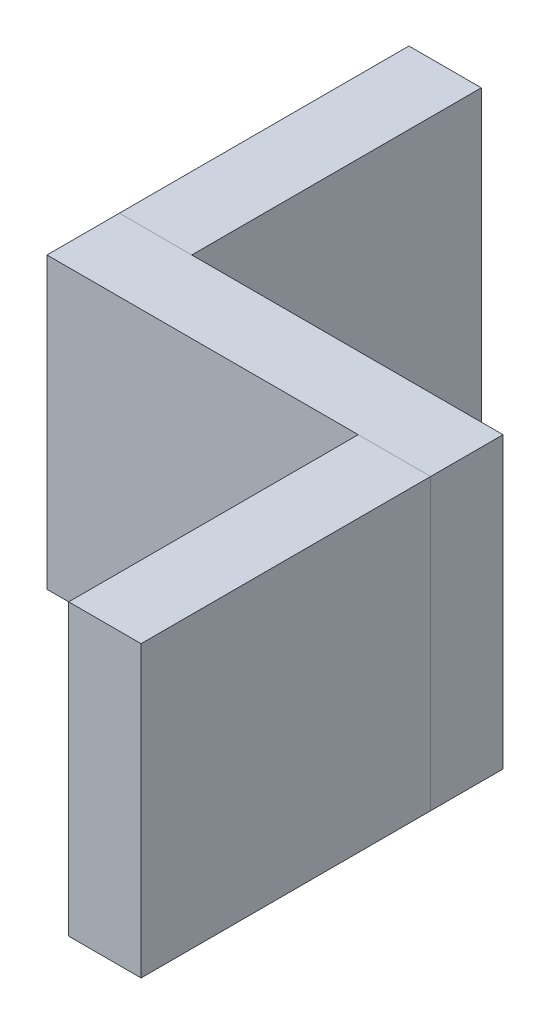
from build123d import *

# Parameters (mm, degrees)
SKETCH_1_W        = 53
SKETCH_1_H        = 40
EXTRUDE_1_DEPTH   = 5
SKETCH_2_W        = 10
SKETCH_2_H        = 40
EXTRUDE_2_DEPTH   = 40
EXTRUDE_2_2_DEPTH = 40


with BuildPart() as part:
    # 草图1 → 凸台-拉伸1 (new, symmetric)
    with BuildSketch(Plane.XY):
        Rectangle(SKETCH_1_W, SKETCH_1_H)
    extrude(amount=EXTRUDE_1_DEPTH, both=True)


with BuildPart() as body_2:
    # 草图2 → 凸台-拉伸2 (new, through all)
    with BuildSketch(Plane.XZ.offset(20)):
        with Locations((-21.5, -25)):
            Rectangle(SKETCH_2_W, SKETCH_2_H)
    extrude(amount=-EXTRUDE_2_DEPTH)


with BuildPart() as body_3:
    # 草图2 → Extrude 2 2 (new, through all)
    with BuildSketch(Plane.XZ.offset(20)):
        with Locations((21.5, 25)):
            Rectangle(SKETCH_2_W, SKETCH_2_H)
    extrude(amount=-EXTRUDE_2_2_DEPTH)


solid = Compound([part.part, body_2.part, body_3.part])
